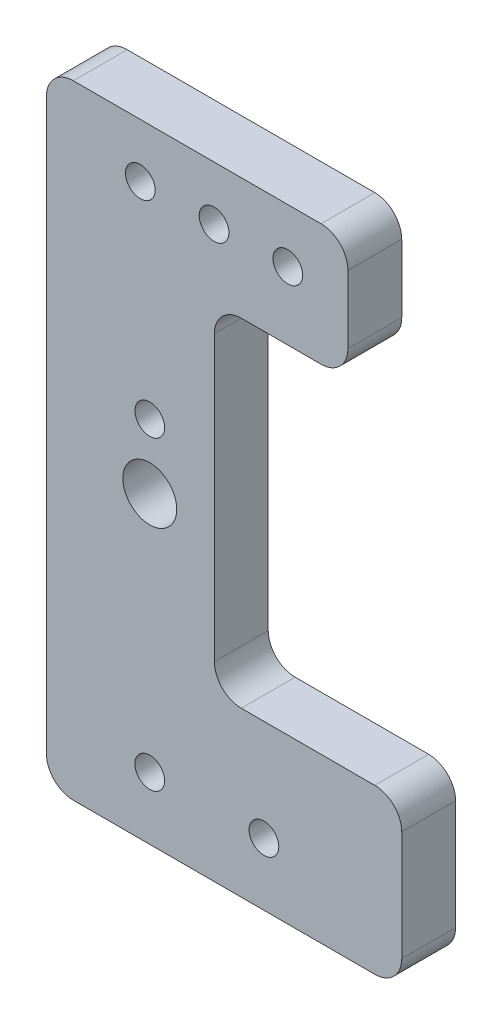
from build123d import *

# Parameters (mm, degrees)
SKETCH1_R           = 1.7526
SKETCH1_R_2         = 3.175
BOSS_EXTRUDE1_DEPTH = 3.175


with BuildPart() as part:
    # Sketch1 → Boss-Extrude1 (new, symmetric)
    with BuildSketch(Plane.XY):
        with BuildLine():
            Line((-16.5989, 7.309993), (12.6111, 7.309993))
            ThreePointArc((12.6111, 7.309993), (14.85616403, 6.38005703), (15.7861, 4.134993))
            Line((15.7861, 4.134993), (15.7861, -3.864460368))
            ThreePointArc((15.7861, -3.864460368), (14.85616403, -6.109524399), (12.6111, -7.039460368))
            Line((12.6111, -7.039460368), (3.2131, -7.039460368))
            ThreePointArc((3.2131, -7.039460368), (0.96803597, -7.969396338), (0.0381, -10.214460368))
            Line((0.0381, -10.214460368), (0.0381, -43.70392319))
            ThreePointArc((0.0381, -43.70392319), (0.96803597, -45.948987221), (3.2131, -46.87892319))
            Line((3.2131, -46.87892319), (18.9611, -46.87892319))
            ThreePointArc((18.9611, -46.87892319), (21.20616403, -47.80885916), (22.1361, -50.05392319))
            Line((22.1361, -50.05392319), (22.1361, -63.00792319))
            ThreePointArc((22.1361, -63.00792319), (21.20616403, -65.252987221), (18.9611, -66.18292319))
            Line((18.9611, -66.18292319), (-16.5989, -66.18292319))
            ThreePointArc((-16.5989, -66.18292319), (-18.84396403, -65.252987221), (-19.7739, -63.00792319))
            Line((-19.7739, -63.00792319), (-19.7739, 4.134993))
            ThreePointArc((-19.7739, 4.134993), (-18.84396403, 6.38005703), (-16.5989, 7.309993))
        make_face()
        with Locations((-8.6995, 0.959993)):
            Circle(SKETCH1_R, mode=Mode.SUBTRACT)
        with Locations((8.6995, 0.959993)):
            Circle(SKETCH1_R, mode=Mode.SUBTRACT)
        with Locations((-7.5819, -22.74892319)):
            Circle(SKETCH1_R, mode=Mode.SUBTRACT)
        with Locations((-7.5819, -30.36892319)):
            Circle(SKETCH1_R_2, mode=Mode.SUBTRACT)
        with Locations((-7.5819, -58.81692319)):
            Circle(SKETCH1_R, mode=Mode.SUBTRACT)
        with Locations((5.8801, -58.81692319)):
            Circle(SKETCH1_R, mode=Mode.SUBTRACT)
        with Locations((0, 0.959993)):
            Circle(SKETCH1_R, mode=Mode.SUBTRACT)
    extrude(amount=BOSS_EXTRUDE1_DEPTH, both=True)


solid = part.part
